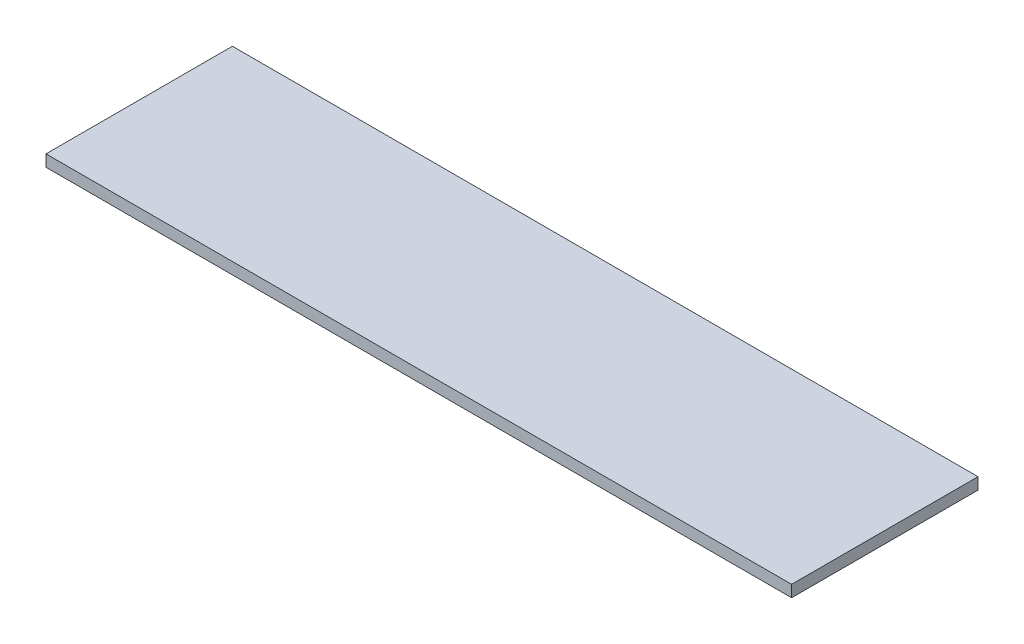
from build123d import *

# Parameters (mm, degrees)
SKETCH2_W           = 101.6
SKETCH2_H           = 25.4
BOSS_EXTRUDE1_DEPTH = 1.5875


with BuildPart() as part:
    # Sketch2 → Boss-Extrude1 (new body)
    with BuildSketch(Plane(origin=(0, 0, 0), x_dir=(1, 0, 0), z_dir=(0, 1, 0))):
        with Locations((50.8, 12.7)):
            Rectangle(SKETCH2_W, SKETCH2_H)
    extrude(amount=BOSS_EXTRUDE1_DEPTH)


solid = part.part
